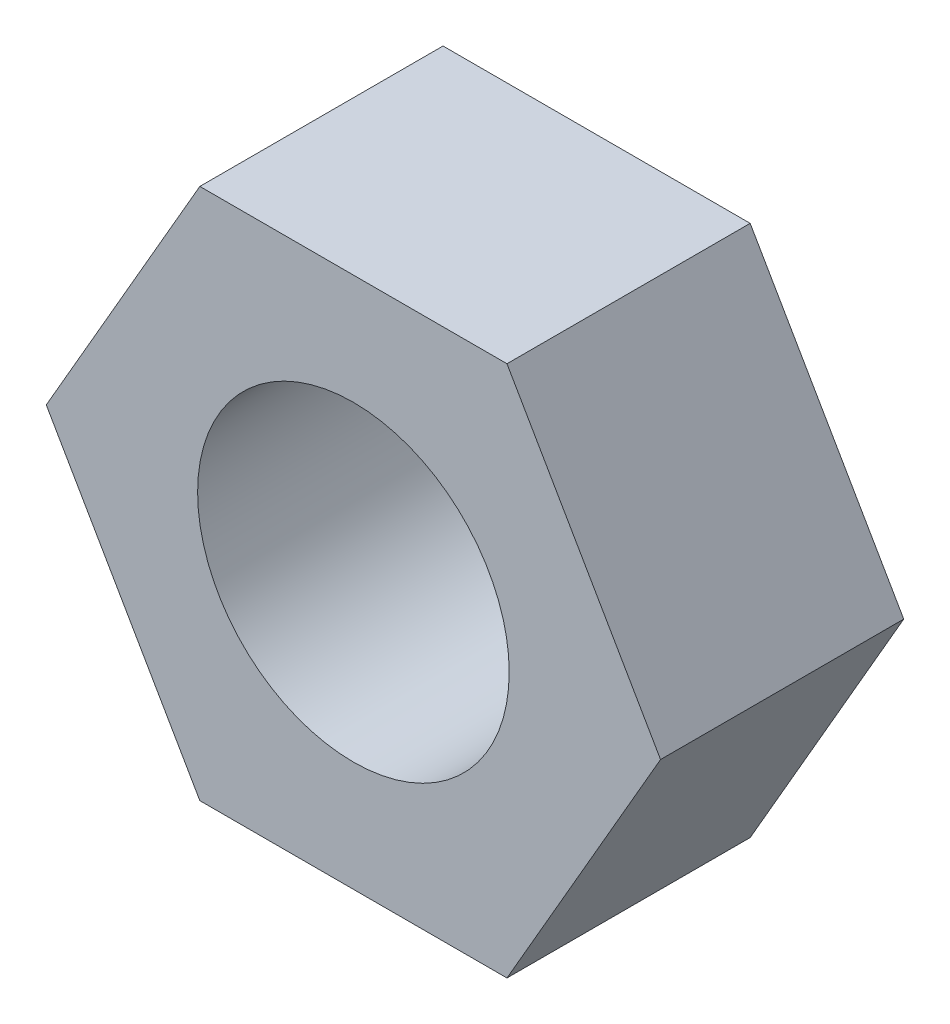
from build123d import *

# Parameters (mm, degrees)
EXTRUDE_1_DEPTH     = 3.2
SKETCH_2_R          = 2.05
CUT_EXTRUDE_1_DEPTH = 7.23083729


with BuildPart() as part:
    # Эскиз1 → Бобышка-Вытянуть1 (new body)
    with BuildSketch(Plane.XY):
        Polygon((4.041451884, 0), (2.020725942, 3.5), (-2.020725942, 3.5), (-4.041451884, 0), (-2.020725942, -3.5), (2.020725942, -3.5), align=None)
    extrude(amount=EXTRUDE_1_DEPTH)

    # Эскиз2 → Вырез-Вытянуть1 (cut, through all)
    with BuildSketch(Plane.XY.offset(3.2)):
        Circle(SKETCH_2_R)
    extrude(amount=-CUT_EXTRUDE_1_DEPTH, mode=Mode.SUBTRACT)


solid = part.part
